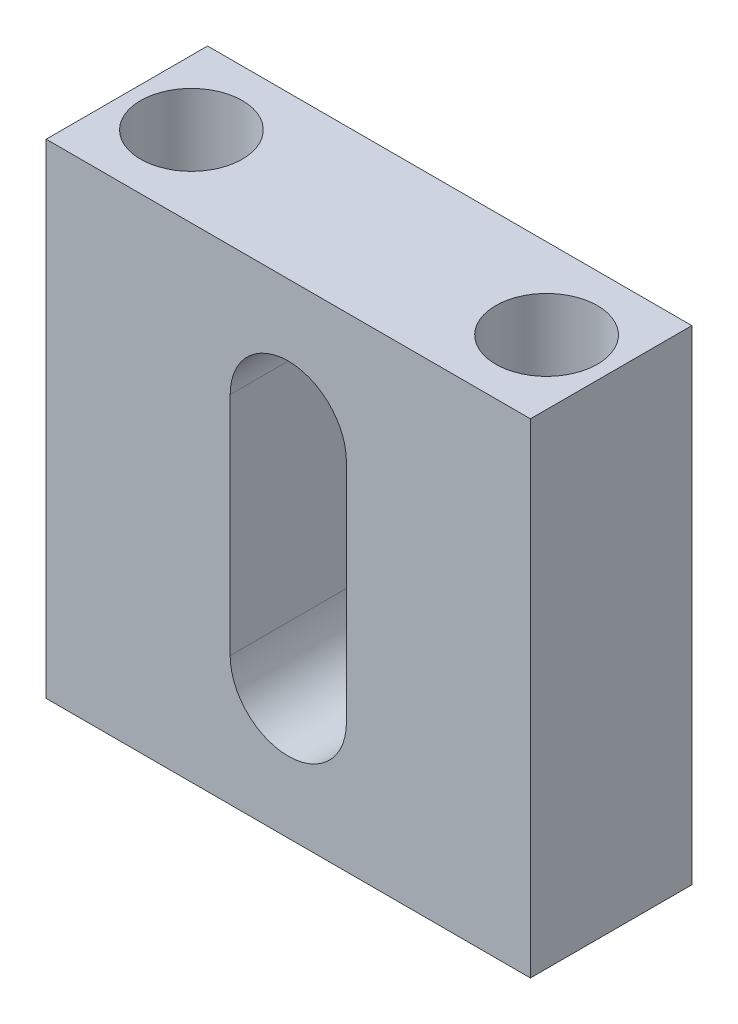
from build123d import *

# Parameters (mm, degrees)
SKETCH1_W           = 19.05
SKETCH1_H           = 19.05
BOSS_EXTRUDE1_DEPTH = 6.35
SKETCH2_R           = 2
CUT_EXTRUDE1_DEPTH  = 28.679008291
CUT_EXTRUDE2_DEPTH  = 28.679008291


with BuildPart() as part:
    # Sketch1 → Boss-Extrude1 (new body)
    with BuildSketch(Plane.XY):
        with Locations((9.525, 9.525)):
            Rectangle(SKETCH1_W, SKETCH1_H)
    extrude(amount=BOSS_EXTRUDE1_DEPTH)

    # Sketch2 → Cut-Extrude1 (cut, through all)
    with BuildSketch(Plane.XZ):
        with Locations(Location((2.54, 3.175, 0), (0, 0, 270))):
            Circle(SKETCH2_R)
        with Locations(Location((16.51, 3.175, 0), (0, 0, 270))):
            Circle(SKETCH2_R)
    extrude(amount=-CUT_EXTRUDE1_DEPTH, mode=Mode.SUBTRACT)

    # Sketch3 → Cut-Extrude2 (cut, through all)
    with BuildSketch(Plane.XY.offset(6.35)):
        with BuildLine():
            ThreePointArc((11.811, 13.97), (9.525, 16.256), (7.239, 13.97))
            Line((7.239, 13.97), (11.811, 13.97))
        make_face()
        with BuildLine():
            Line((11.811, 13.97), (7.239, 13.97))
            ThreePointArc((7.239, 13.97), (9.525, 11.684), (11.811, 13.97))
        make_face()
        with BuildLine():
            ThreePointArc((11.811, 13.97), (9.525, 11.684), (7.239, 13.97))
            Line((7.239, 13.97), (7.239, 5.08))
            ThreePointArc((7.239, 5.08), (9.525, 7.366), (11.811, 5.08))
            Line((11.811, 5.08), (11.811, 13.97))
        make_face()
        with BuildLine():
            ThreePointArc((11.811, 5.08), (9.525, 7.366), (7.239, 5.08))
            Line((7.239, 5.08), (11.811, 5.08))
        make_face()
        with BuildLine():
            Line((11.811, 5.08), (7.239, 5.08))
            ThreePointArc((7.239, 5.08), (9.525, 2.794), (11.811, 5.08))
        make_face()
    extrude(amount=-CUT_EXTRUDE2_DEPTH, mode=Mode.SUBTRACT)


solid = part.part
